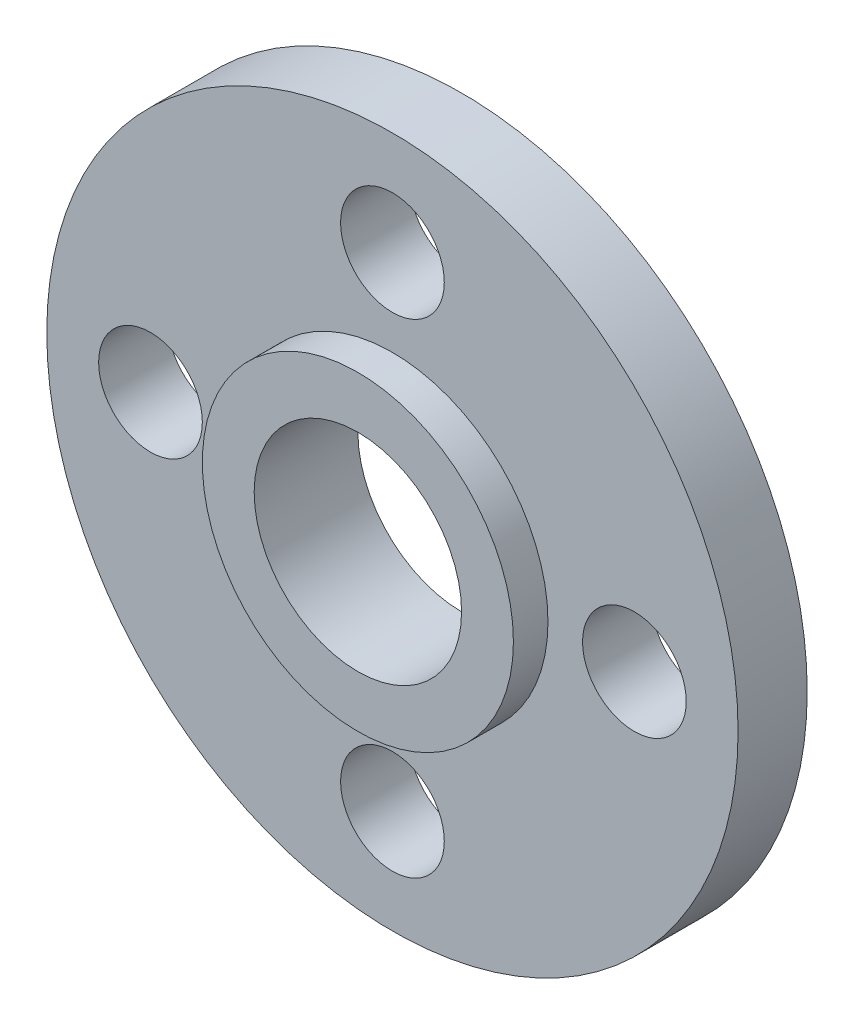
from build123d import *

# Parameters (mm, degrees)
SKETCH1_R       = 10
EXTRUDE1_DEPTH  = 2.5
SKETCH2_R       = 4.5
SKETCH2_R_2     = 3
EXTRUDE2_DEPTH  = 2
SKETCH3_R       = 1.5
EXTRUDE3_DEPTH  = 13
SKETCH4_R       = 1.5
EXTRUDE4_DEPTH  = 13
EXTRUDE5_START  = -13
SKETCH5_R       = 3
EXTRUDE5_DEPTH  = 13
EXTRUDE6_START  = -1
SKETCH6_R       = 4.5
EXTRUDE6_DEPTH  = 1
EXTRUDE7_START  = -0.5
SKETCH7_R       = 10
SKETCH7_R_2     = 4.5
EXTRUDE7_DEPTH  = 0.5
EXTRUDE8_START  = -0.5
SKETCH8_R       = 4.5
EXTRUDE8_DEPTH  = 0.5
SKETCH9_R       = 10
SKETCH9_R_2     = 3
EXTRUDE9_DEPTH  = 2
SKETCH10_R      = 1.5
EXTRUDE10_DEPTH = 12.3


with BuildPart() as part:
    # Sketch1 → Extrude1 (new body)
    with BuildSketch(Plane.XY):
        Circle(SKETCH1_R)
    extrude(amount=EXTRUDE1_DEPTH)

    # Sketch2 → Extrude2 (add)
    with BuildSketch(Plane.XY.offset(2.5)):
        Circle(SKETCH2_R)
        Circle(SKETCH2_R_2, mode=Mode.SUBTRACT)
    extrude(amount=EXTRUDE2_DEPTH)

    # Sketch3 → Extrude3 (cut)
    with BuildSketch(Plane.XY.offset(2.5)):
        Circle(SKETCH3_R)
    extrude(amount=-EXTRUDE3_DEPTH, mode=Mode.SUBTRACT)

    # Sketch4 → Extrude4 (cut)
    with BuildSketch(Plane.XY.offset(2.5)):
        with Locations((0, 7.25)):
            Circle(SKETCH4_R)
        with Locations((7.25, 0)):
            Circle(SKETCH4_R)
        with Locations((0, -7.25)):
            Circle(SKETCH4_R)
        with Locations((-7.25, 0)):
            Circle(SKETCH4_R)
    extrude(amount=-EXTRUDE4_DEPTH, mode=Mode.SUBTRACT)

    # Sketch5 → Extrude5 (cut)
    with BuildSketch(Plane.XY.offset(2.5).offset(EXTRUDE5_START)):
        Circle(SKETCH5_R)
    extrude(amount=EXTRUDE5_DEPTH, mode=Mode.SUBTRACT)

    # Sketch6 → Extrude6 (cut)
    with BuildSketch(Plane.XY.offset(4.5).offset(EXTRUDE6_START)):
        Circle(SKETCH6_R)
    extrude(amount=EXTRUDE6_DEPTH, mode=Mode.SUBTRACT)

    # Sketch7 → Extrude7 (cut)
    with BuildSketch(Plane.XY.offset(2.5).offset(EXTRUDE7_START)):
        Circle(SKETCH7_R)
        Circle(SKETCH7_R_2, mode=Mode.SUBTRACT)
    extrude(amount=EXTRUDE7_DEPTH, mode=Mode.SUBTRACT)

    # Sketch8 → Extrude8 (cut)
    with BuildSketch(Plane.XY.offset(3.5).offset(EXTRUDE8_START)):
        Circle(SKETCH8_R)
    extrude(amount=EXTRUDE8_DEPTH, mode=Mode.SUBTRACT)

    # Sketch9 → Extrude9 (add)
    with BuildSketch(Plane(origin=(0, 0, 0), x_dir=(-1, 0, 0), z_dir=(0, 0, -1))):
        with Locations(Location((0, 0, 0), (0, 0, 180))):
            Circle(SKETCH9_R)
        with Locations(Location((0, 0, 0), (0, 0, 180))):
            Circle(SKETCH9_R_2, mode=Mode.SUBTRACT)
    extrude(amount=-EXTRUDE9_DEPTH)

    # Sketch10 → Extrude10 (cut)
    with BuildSketch(Plane(origin=(0, 0, 0), x_dir=(-1, 0, 0), z_dir=(0, 0, -1))):
        with Locations((0, 7)):
            Circle(SKETCH10_R)
        with Locations((7, 0)):
            Circle(SKETCH10_R)
        with Locations((0, -7)):
            Circle(SKETCH10_R)
        with Locations((-7, 0)):
            Circle(SKETCH10_R)
    extrude(amount=-EXTRUDE10_DEPTH, mode=Mode.SUBTRACT)


solid = part.part
